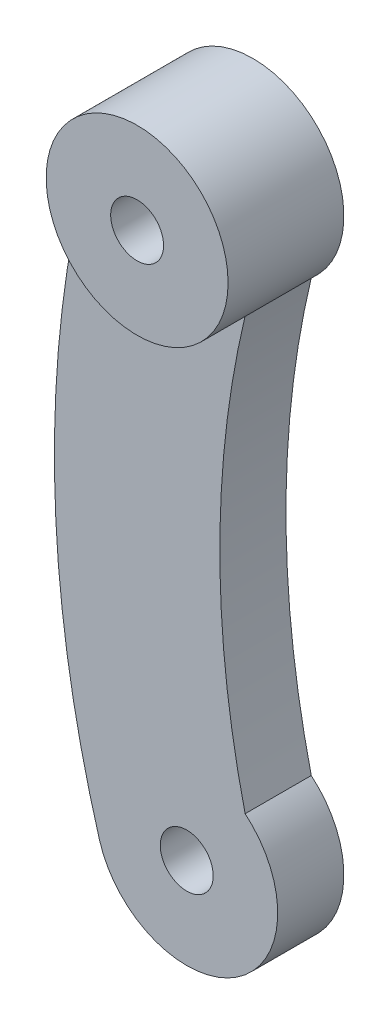
from build123d import *

# Parameters (mm, degrees)
IZIM1_R                     = 1.6
Y_KSEKLIK_EKSTR_ZYON1_DEPTH = 4
IZIM3_R                     = 5.5
IZIM3_R_2                   = 1.6
Y_KSEKLIK_EKSTR_ZYON3_DEPTH = 3
KES_EKSTR_ZYON1_DEPTH       = 4


with BuildPart() as part:
    # Çizim1 → Yükseklik-Ekstrüzyon1 (new body)
    with BuildSketch(Plane.XY):
        with BuildLine():
            ThreePointArc((-5.273709113, -1.561407118), (3.018112795, -4.597933792), (3.530207231, 4.2175392))
            ThreePointArc((3.530207231, 4.2175392), (2, 17.25), (3.530207231, 30.2824608))
            ThreePointArc((3.530207231, 30.2824608), (3.018112795, 39.097933792), (-5.273709113, 36.061407118))
            ThreePointArc((-5.273709113, 36.061407118), (-8, 17.25), (-5.273709113, -1.561407118))
        make_face()
        with Locations((0, 34.5)):
            Circle(IZIM1_R, mode=Mode.SUBTRACT)
        Circle(IZIM1_R, mode=Mode.SUBTRACT)
    extrude(amount=Y_KSEKLIK_EKSTR_ZYON1_DEPTH)

    # Çizim3 → Yükseklik-Ekstrüzyon3 (add)
    with BuildSketch(Plane.XY.offset(4)):
        with Locations(Location((0, 34.5, 0), (0, 0, 163.507358371))):
            Circle(IZIM3_R)
        with Locations((0, 34.5)):
            Circle(IZIM3_R_2, mode=Mode.SUBTRACT)
    extrude(amount=Y_KSEKLIK_EKSTR_ZYON3_DEPTH)

    # Çizim4 → Kes-Ekstrüzyon1 (cut)
    with BuildSketch(Plane(origin=(0, 0, 0), x_dir=(-1, 0, 0), z_dir=(0, 0, -1))):
        Polygon((2.9, 36.174315781), (0, 37.848631561), (-2.9, 36.174315781), (-2.9, 32.825684219), (0, 31.151368439), (2.9, 32.825684219), align=None)
    extrude(amount=-KES_EKSTR_ZYON1_DEPTH, mode=Mode.SUBTRACT)


solid = part.part
